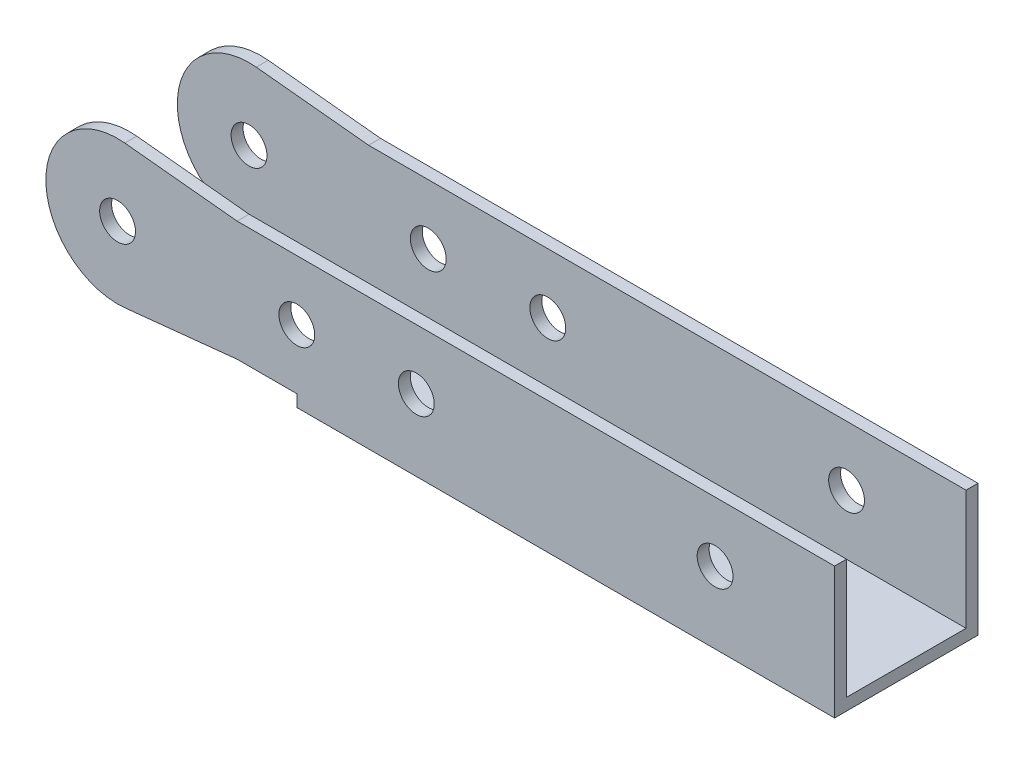
from build123d import *

# Parameters (mm, degrees)
SKETCH_3_R      = 1.5
EXTRUDE_1_DEPTH = 1
SKETCH_1_R      = 1.5
EXTRUDE_2_DEPTH = 1
SKETCH_4_W      = 45
SKETCH_4_H      = 12
EXTRUDE_3_DEPTH = 1


with BuildPart() as part:
    # 草图3 → 凸台-拉伸1 (new body)
    with BuildSketch(Plane.XY.offset(10)):
        with BuildLine():
            Line((-26.8, 8.010393038), (-36.190694621, 8.96898207))
            ThreePointArc((-36.190694621, 8.96898207), (-42.7999991, 2.996713251), (-36.184155472, -2.968310943))
            Line((-36.184155472, -2.968310943), (-26.8, -2))
            Line((-26.8, -2), (23.2, -2))
            Line((23.2, -2), (23.2, 8.010393038))
            Line((23.2, 8.010393038), (-26.8, 8.010393038))
        make_face()
        with Locations((13.2, 3)):
            Circle(SKETCH_3_R, mode=Mode.SUBTRACT)
        with Locations((-11.8, 3)):
            Circle(SKETCH_3_R, mode=Mode.SUBTRACT)
        with Locations((-21.8, 3)):
            Circle(SKETCH_3_R, mode=Mode.SUBTRACT)
        with Locations((-36.8, 3)):
            Circle(SKETCH_3_R, mode=Mode.SUBTRACT)
    extrude(amount=EXTRUDE_1_DEPTH)



with BuildPart() as body_2:
    # 草图1 → 凸台-拉伸2 (new body)
    with BuildSketch(Plane.XY):
        with BuildLine():
            Line((23.2, 8.010393038), (-26.8, 8.010393038))
            Line((-26.8, 8.010393038), (-36.190694621, 8.96898207))
            ThreePointArc((-36.190694621, 8.96898207), (-42.7999991, 2.996713251), (-36.184155472, -2.968310943))
            Line((-36.184155472, -2.968310943), (-26.8, -2))
            Line((-26.8, -2), (23.2, -2))
            Line((23.2, -2), (23.2, 8.010393038))
        make_face()
        with Locations((-36.8, 3)):
            Circle(SKETCH_1_R, mode=Mode.SUBTRACT)
        with Locations((-21.8, 3)):
            Circle(SKETCH_1_R, mode=Mode.SUBTRACT)
        with Locations((-11.8, 3)):
            Circle(SKETCH_1_R, mode=Mode.SUBTRACT)
        with Locations((13.2, 3)):
            Circle(SKETCH_1_R, mode=Mode.SUBTRACT)
    extrude(amount=-EXTRUDE_2_DEPTH)


with BuildPart() as part_1:
    add(part.part)

    add(body_2.part)  # 凸台-拉伸3 merges body 2
    # 草图4 → 凸台-拉伸3 (add)
    with BuildSketch(Plane.XZ.offset(2)):
        with Locations((0.7, 5)):
            Rectangle(SKETCH_4_W, SKETCH_4_H)
    extrude(amount=EXTRUDE_3_DEPTH)


solid = part_1.part
